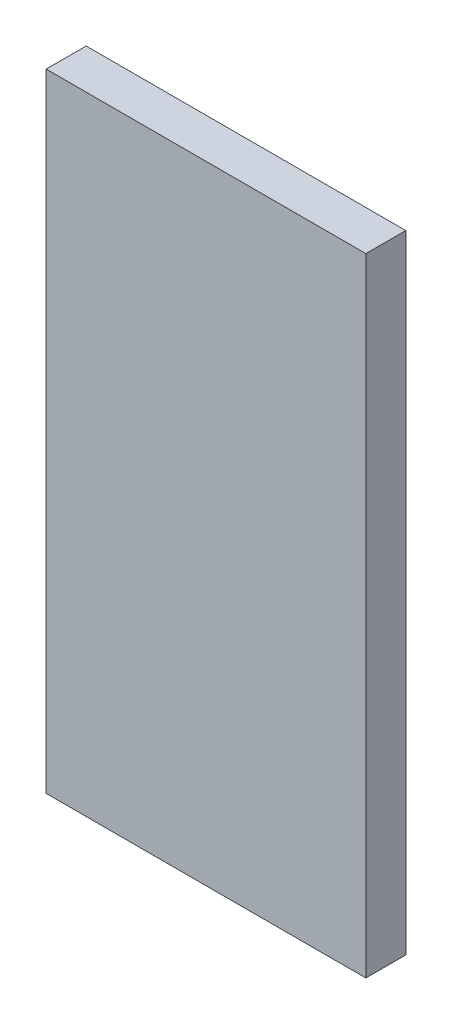
from build123d import *

# Parameters (mm, degrees)
SKETCH1_W           = 50.8
SKETCH1_H           = 99.70008
BOSS_EXTRUDE1_DEPTH = 6.35


with BuildPart() as part:
    # Sketch1 → Boss-Extrude1 (new body)
    with BuildSketch(Plane.XY):
        Rectangle(SKETCH1_W, SKETCH1_H)
    extrude(amount=BOSS_EXTRUDE1_DEPTH)


solid = part.part
